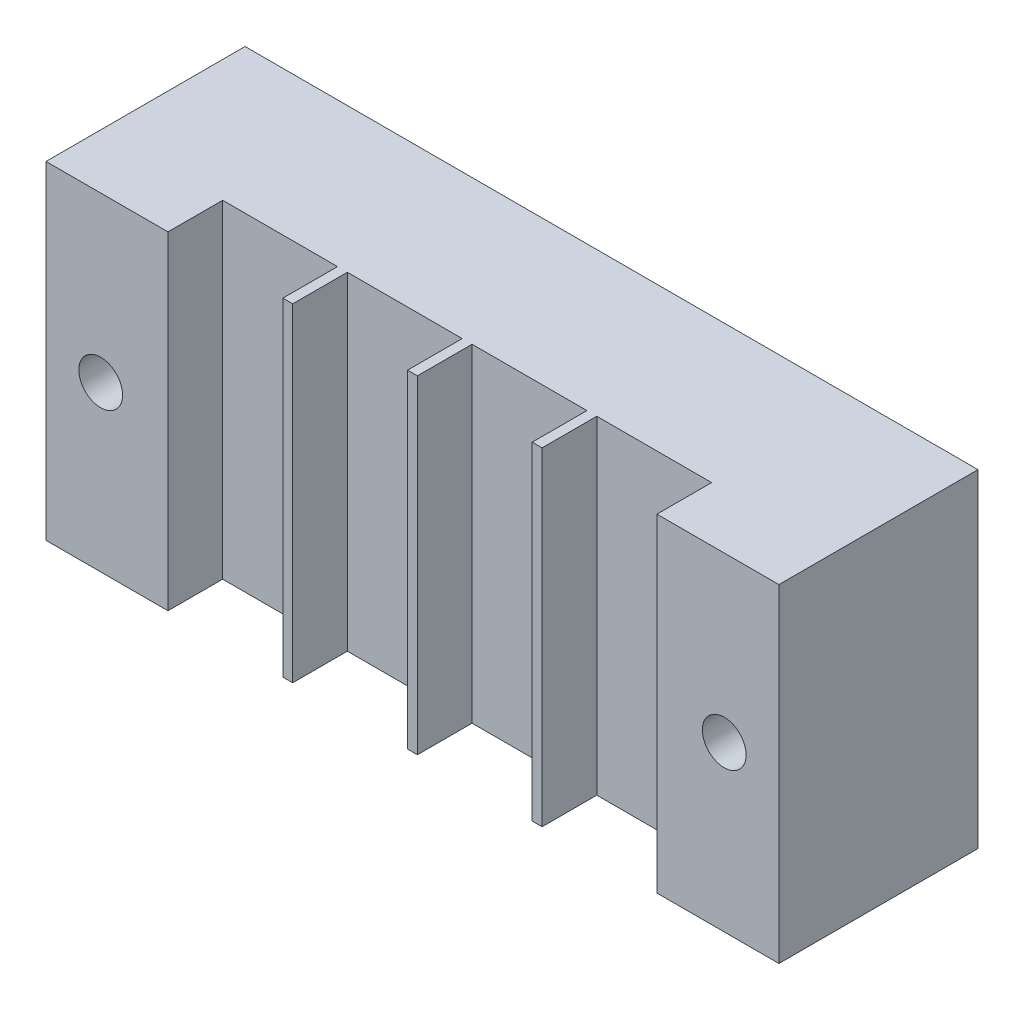
from build123d import *

# Parameters (mm, degrees)
SKETCH_1_W          = 67
SKETCH_1_H          = 30
EXTRUDE_1_DEPTH     = 18.2
SKETCH_2_R          = 2
CUT_EXTRUDE_1_DEPTH = 19
SKETCH_3_W          = 10.5
SKETCH_3_H          = 30
CUT_EXTRUDE_2_DEPTH = 5


with BuildPart() as part:
    # 草图1 → 凸台-拉伸1 (new body)
    with BuildSketch(Plane.XY):
        Rectangle(SKETCH_1_W, SKETCH_1_H)
    extrude(amount=EXTRUDE_1_DEPTH)

    # 草图2 → 切除-拉伸1 (cut)
    with BuildSketch(Plane.XY.offset(18.2)):
        with Locations((-28.5, 0)):
            Circle(SKETCH_2_R)
        with Locations((28.5, 0)):
            Circle(SKETCH_2_R)
    extrude(amount=-CUT_EXTRUDE_1_DEPTH, mode=Mode.SUBTRACT)

    # 草图3 → 切除-拉伸2 (cut)
    with BuildSketch(Plane.XY.offset(18.2)):
        with Locations((-5.7, 0)):
            Rectangle(SKETCH_3_W, SKETCH_3_H)
        with Locations((-17.1, 0)):
            Rectangle(SKETCH_3_W, SKETCH_3_H)
        with Locations((17.1, 0)):
            Rectangle(SKETCH_3_W, SKETCH_3_H)
        with Locations((5.7, 0)):
            Rectangle(SKETCH_3_W, SKETCH_3_H)
    extrude(amount=-CUT_EXTRUDE_2_DEPTH, mode=Mode.SUBTRACT)


solid = part.part
